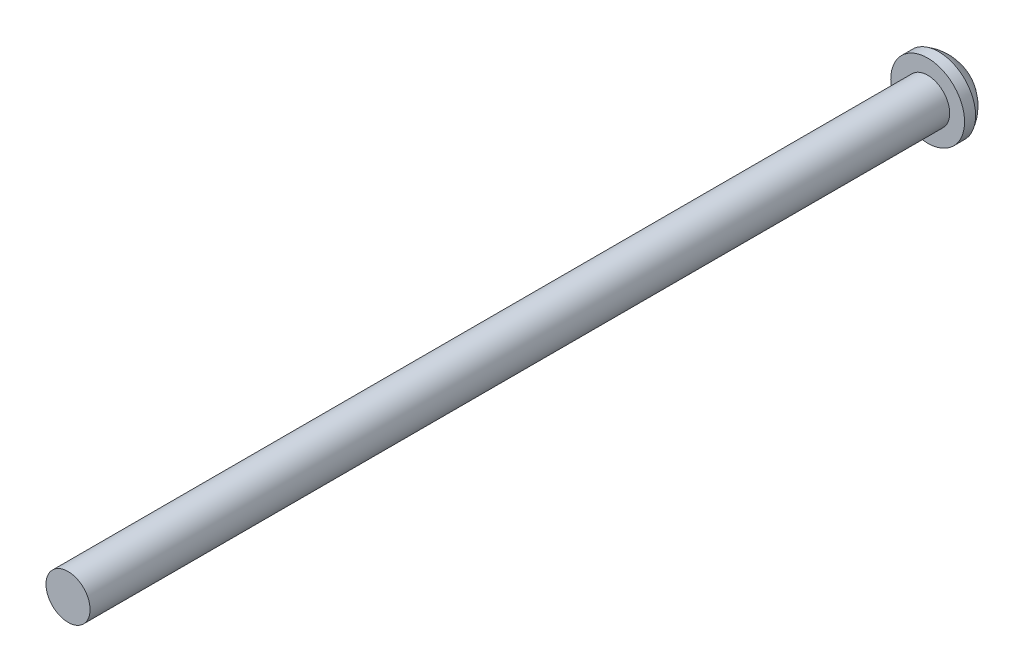
from build123d import *

# Parameters (mm, degrees)
SKETCH1_R         = 2
EXTRUDE1_DEPTH    = 78
SKETCH2_R         = 3.35
EXTRUDE2_DEPTH    = 1
DOME1_FACE_RADIUS = 3.35
DOME1_HEIGHT      = 2


with BuildPart() as part:
    # Sketch1 → Extrude1 (new body)
    with BuildSketch(Plane.XY):
        Circle(SKETCH1_R)
    extrude(amount=EXTRUDE1_DEPTH)

    # Sketch2 → Extrude2 (add)
    with BuildSketch(Plane(origin=(0, 0, 0), x_dir=(-1, 0, 0), z_dir=(0, 0, -1))):
        Circle(SKETCH2_R)
    extrude(amount=EXTRUDE2_DEPTH)

    # Dome1: a dome of height H over a round flat face of radius A is a cap of a sphere of radius (A * A + H * H) / (2 * H)
    dome1_r = (DOME1_FACE_RADIUS * DOME1_FACE_RADIUS + DOME1_HEIGHT * DOME1_HEIGHT) / (2 * DOME1_HEIGHT)
    dome1_base = Plane((0, 0, -1), z_dir=(0, 0, -1))
    with Locations(dome1_base.offset(DOME1_HEIGHT - dome1_r)):
        dome1_ball = Sphere(dome1_r, mode=Mode.PRIVATE)
    add(split(dome1_ball, bisect_by=dome1_base, keep=Keep.TOP, mode=Mode.PRIVATE))


solid = part.part
